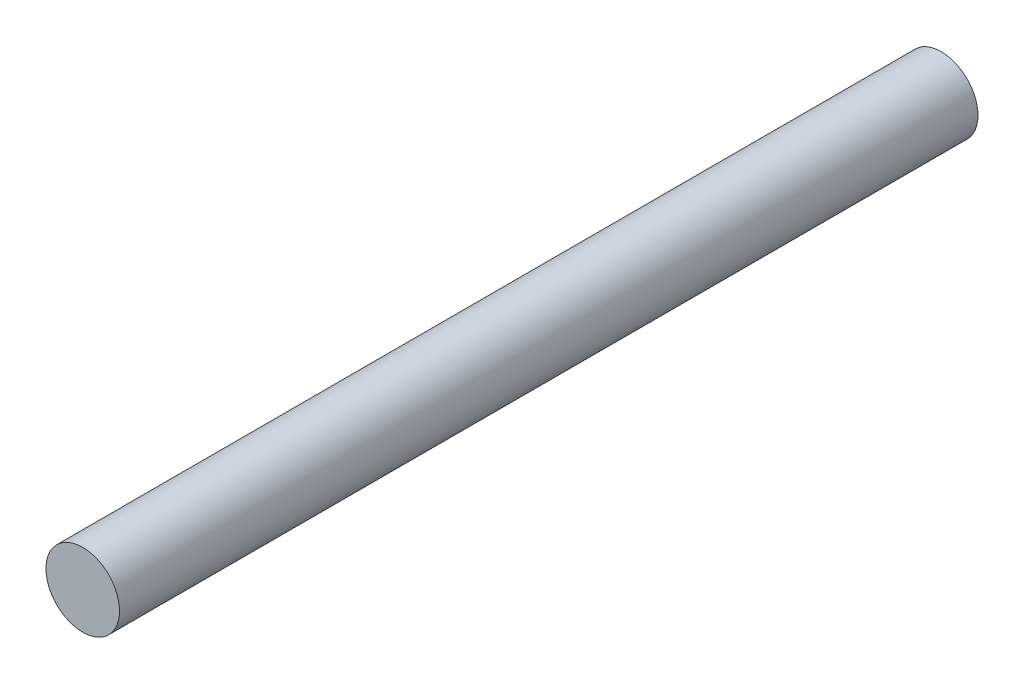
from build123d import *

# Parameters (mm, degrees)
ESQUISSE1_R        = 1.5
BOSS_EXTRU_1_DEPTH = 35


with BuildPart() as part:
    # Esquisse1 → Boss.-Extru.1 (new body)
    with BuildSketch(Plane.XY):
        Circle(ESQUISSE1_R)
    extrude(amount=BOSS_EXTRU_1_DEPTH)


solid = part.part
